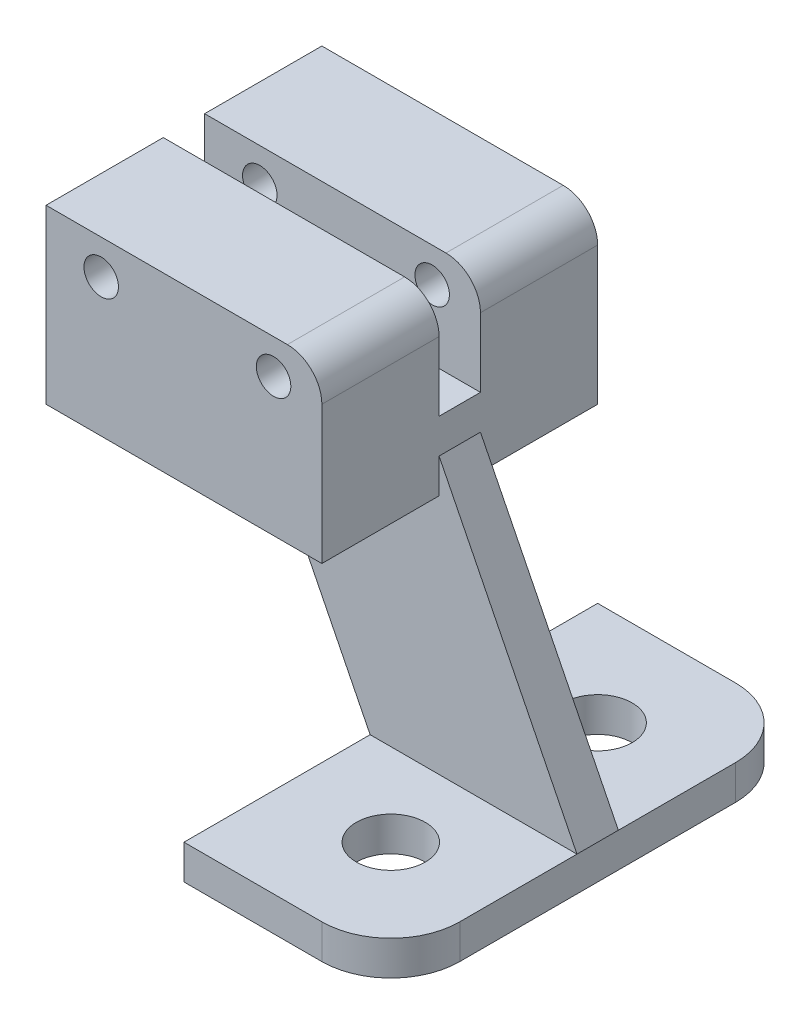
from build123d import *

# Parameters (mm, degrees)
SKETCH1_W                  = 30
SKETCH1_H                  = 5
BOSS_EXTRUDE1_DEPTH        = 60
FILLET1_R                  = 10
F_10_0_10_DIAMETER_HOLE1_D = 10
SKETCH4_W                  = 50
SKETCH4_H                  = 6
BOSS_EXTRUDE4_DEPTH        = 40
CUT_EXTRUDE3_DEPTH         = 40
BOSS_EXTRUDE5_DEPTH        = 20
BOSS_EXTRUDE5_DEPTH_BACK   = 5
F_5_0_5_DIAMETER_HOLE1_D   = 5
CUT_EXTRUDE4_DEPTH         = 108.392141664
FILLET2_R                  = 5
FILLET3_R                  = 5


with BuildPart() as part:
    # Sketch1 → Boss-Extrude1 (new body)
    with BuildSketch(Plane.XY):
        with Locations((48.564868256, 17.080601224)):
            Rectangle(SKETCH1_W, SKETCH1_H)
    extrude(amount=BOSS_EXTRUDE1_DEPTH)

    # Fillet1
    fillet1_edges = [part.edges().sort_by_distance(p)[0] for p in [
        (63.564868256, 17.080601224, 60),
        (63.564868256, 17.080601224, 0),
    ]]
    fillet(fillet1_edges, radius=FILLET1_R)

    # Ø10.0 (10) Diameter Hole1 (through all)
    with Locations(Plane(origin=(48.564868256, 19.580601224, 15), x_dir=(0, 0, 1), z_dir=(0, 1, 0))):
        with Locations((0, 0), (30, 0)):
            Hole(F_10_0_10_DIAMETER_HOLE1_D / 2)

    # Sketch4 → Boss-Extrude4 (add)
    with BuildSketch(Plane(origin=(0, 19.580601224, 0), x_dir=(1, 0, 0), z_dir=(0, 1, 0))):
        with Locations((38.564868256, -30)):
            Rectangle(SKETCH4_W, SKETCH4_H)
    extrude(amount=BOSS_EXTRUDE4_DEPTH)

    # Sketch10 → Cut-Extrude3 (cut)
    with BuildSketch(Plane.XY.offset(33)):
        Polygon((33.564868256, 19.580601224), (13.564868256, 59.580601224), (13.564868256, 19.580601224), align=None)
        Polygon((63.564868256, 59.580601224), (43.564868256, 59.580601224), (63.564868256, 19.580601224), align=None)
    extrude(amount=-CUT_EXTRUDE3_DEPTH, mode=Mode.SUBTRACT)

    # Sketch11 → Boss-Extrude5 (add, two sides: drawn at the far end of the back side and taken through both)
    with BuildSketch(Plane(origin=(0, 59.580601224, 0), x_dir=(1, 0, 0), z_dir=(0, 1, 0)).offset(-BOSS_EXTRUDE5_DEPTH_BACK)):
        Polygon((43.564868256, -30), (43.564868256, -10), (3.564868256, -10), (3.564868256, -50), (43.564868256, -50), align=None)
    extrude(amount=BOSS_EXTRUDE5_DEPTH + BOSS_EXTRUDE5_DEPTH_BACK)

    # Ø5.0 (5) Diameter Hole1 (through all)
    with Locations(Plane(origin=(36.564868256, 74.580601224, 50), x_dir=(1, 0, 0), z_dir=(0, 0, 1))):
        with Locations((0, 0), (-25, 0)):
            Hole(F_5_0_5_DIAMETER_HOLE1_D / 2)

    # Sketch15 → Cut-Extrude4 (cut, through all)
    with BuildSketch(Plane(origin=(43.564868256, 0, 0), x_dir=(0, 0, -1), z_dir=(1, 0, 0))):
        Polygon((-30, 64.580601224), (-27, 64.580601224), (-27, 79.580601224), (-33, 79.580601224), (-33, 64.580601224), align=None)
    extrude(amount=-CUT_EXTRUDE4_DEPTH, mode=Mode.SUBTRACT)

    # Fillet2
    fillet2_edges = [part.edges().sort_by_distance(p)[0] for p in [
        (43.564868256, 79.580601224, 41.5),
    ]]
    fillet(fillet2_edges, radius=FILLET2_R)

    # Fillet3
    fillet3_edges = [part.edges().sort_by_distance(p)[0] for p in [
        (43.564868256, 79.580601224, 18.5),
    ]]
    fillet(fillet3_edges, radius=FILLET3_R)


solid = part.part
